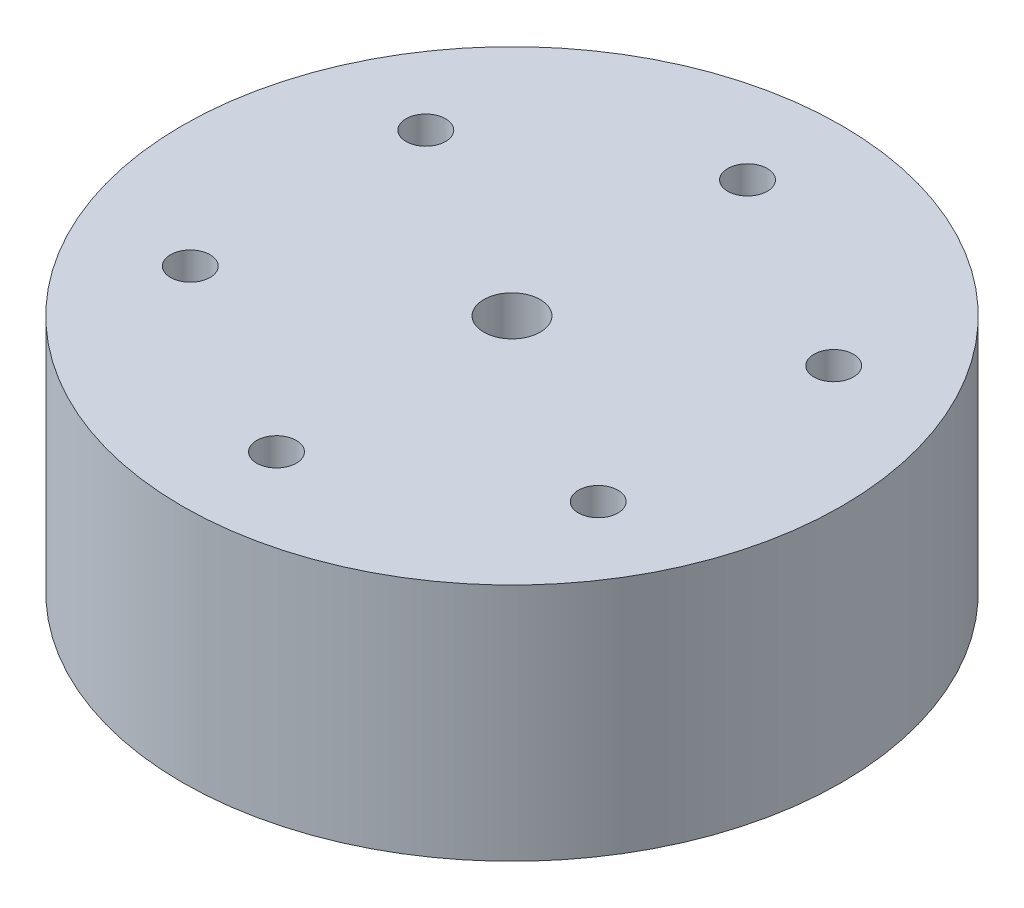
from build123d import *

# Parameters (mm, degrees)
SKETCH2_R           = 35
BOSS_EXTRUDE1_DEPTH = 25.4
CUT_EXTRUDE1_DEPTH  = 56.634162167
SKETCH5_R           = 2.1
CUT_EXTRUDE3_DEPTH  = 56.634162167


with BuildPart() as part:
    # Sketch2 → Boss-Extrude1 (new body)
    with BuildSketch(Plane(origin=(0, 0, 0), x_dir=(1, 0, 0), z_dir=(0, 1, 0))):
        with Locations(Location((0, 0, 0), (0, 0, 270))):
            Circle(SKETCH2_R)
    extrude(amount=BOSS_EXTRUDE1_DEPTH)

    # Sketch3 → Cut-Extrude1 (cut, through all)
    with BuildSketch(Plane(origin=(0, 25.4, 0), x_dir=(1, 0, 0), z_dir=(0, 1, 0))):
        with BuildLine():
            ThreePointArc((-1.658312395, 2.5), (0, -3), (1.658312395, 2.5))
            ThreePointArc((1.658312395, 2.5), (0, 3), (-1.658312395, 2.5))
        make_face()
    extrude(amount=-CUT_EXTRUDE1_DEPTH, mode=Mode.SUBTRACT)

    # Sketch5 → Cut-Extrude3 (cut, through all)
    with BuildSketch(Plane(origin=(0, 25.4, 0), x_dir=(1, 0, 0), z_dir=(0, 1, 0))):
        with Locations(Location((0, 25, 0), (0, 0, 270))):
            Circle(SKETCH5_R)
        with Locations(Location((21.650635095, 12.5, 0), (0, 0, 270))):
            Circle(SKETCH5_R)
        with Locations(Location((21.650635095, -12.5, 0), (0, 0, 270))):
            Circle(SKETCH5_R)
        with Locations(Location((0, -25, 0), (0, 0, 270))):
            Circle(SKETCH5_R)
        with Locations(Location((-21.650635095, -12.5, 0), (0, 0, 270))):
            Circle(SKETCH5_R)
        with Locations(Location((-21.650635095, 12.5, 0), (0, 0, 270))):
            Circle(SKETCH5_R)
    extrude(amount=-CUT_EXTRUDE3_DEPTH, mode=Mode.SUBTRACT)


solid = part.part
